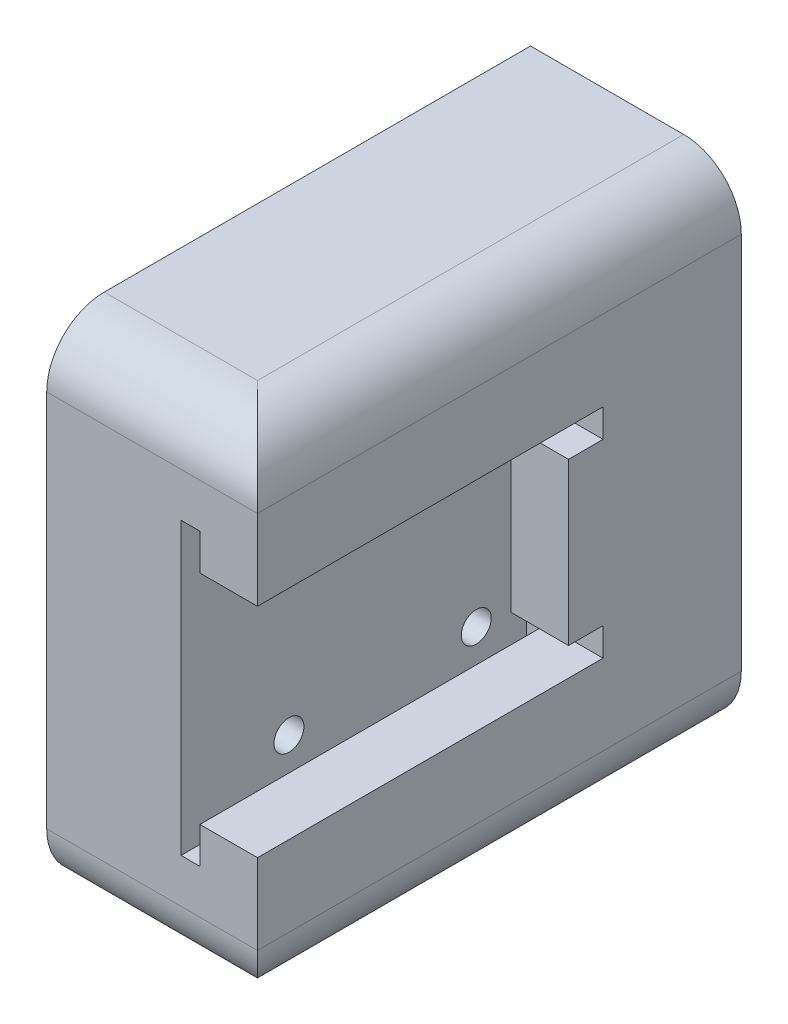
from build123d import *

# Parameters (mm, degrees)
SKETCH_1_W          = 18.3
SKETCH_1_H          = 42.85
SKETCH_1_R          = 1.55
EXTRUDE_1_DEPTH     = 7
SKETCH_2_W          = 5
SKETCH_2_H          = 14
EXTRUDE_4_DEPTH     = 8
SKETCH_5_W          = 5
SKETCH_5_H          = 3.15
EXTRUDE_5_DEPTH     = 35
EXTRUDE_7_DEPTH     = 35
EXTRUDE_8_DEPTH     = 5
CUT_EXTRUDE_1_REACH = 63.123
SKETCH_9_R          = 1.3
SKETCH_11_R         = 1.55
CUT_EXTRUDE_2_DEPTH = 32
SKETCH_12_W         = 6
SKETCH_12_H         = 6
CUT_EXTRUDE_3_DEPTH = 3.2
FILLET_1_R          = 5


with BuildPart() as part:
    # 草图1 → 凸台-拉伸1 (new body)
    with BuildSketch(Plane.XY):
        with Locations((9.15, -21.425)):
            Rectangle(SKETCH_1_W, SKETCH_1_H)
        with Locations((5.15, -5)):
            Circle(SKETCH_1_R, mode=Mode.SUBTRACT)
        with Locations((5.15, -37.96)):
            Circle(SKETCH_1_R, mode=Mode.SUBTRACT)
        with Locations(Location((13.15, -37.96, 0), (0, 0, 180))):
            Circle(SKETCH_1_R, mode=Mode.SUBTRACT)
        with Locations(Location((13.15, -5, 0), (0, 0, 180))):
            Circle(SKETCH_1_R, mode=Mode.SUBTRACT)
    extrude(amount=EXTRUDE_1_DEPTH)

    # 草图2 → 凸台-拉伸4 (add)
    with BuildSketch(Plane.XY.offset(7)):
        with Locations((15.8, -21.425)):
            Rectangle(SKETCH_2_W, SKETCH_2_H)
    extrude(amount=EXTRUDE_4_DEPTH)

    # 草图5 → 凸台-拉伸5 (add)
    with BuildSketch(Plane.XY.offset(7)):
        with Locations((15.8, -32.45)):
            Rectangle(SKETCH_5_W, SKETCH_5_H)
        with Locations((15.8, -10.4)):
            Rectangle(SKETCH_5_W, SKETCH_5_H)
    extrude(amount=EXTRUDE_5_DEPTH)

    # 草图7 → 凸台-拉伸7 (add)
    with BuildSketch(Plane.XY.offset(7)):
        Polygon((0, 0), (12.7, 0), (18.3, 0), (18.3, -8.825), (11.66, -8.825), (11.66, -34.025), (18.3, -34.025), (18.3, -42.85), (12.7, -42.85), (0, -42.85), align=None)
    extrude(amount=EXTRUDE_7_DEPTH)

    # 草图8 → 凸台-拉伸8 (add)
    with BuildSketch(Plane.XY.offset(7)):
        Polygon((13.3, -30.875), (13.3, -34.025), (11.66, -34.025), (11.66, -8.825), (13.3, -8.825), (13.3, -11.975), (18.3, -11.975), (18.3, -14.425), (13.3, -14.425), (13.3, -28.425), (18.3, -28.425), (18.3, -30.875), align=None)
    extrude(amount=EXTRUDE_8_DEPTH)

    # 草图9 → 切除-拉伸1 (cut, up to next)
    with BuildSketch(Plane(origin=(11.66, 0, 0), x_dir=(0, 0, -1), z_dir=(1, 0, 0)), mode=Mode.PRIVATE) as cut_extrude_1_sk1:
        with Locations(Location((-16.37, -13.195, 0), (0, 0, 90))):
            Circle(SKETCH_9_R)
    cut_extrude_1_tool1 = extrude(cut_extrude_1_sk1.sketch, amount=-CUT_EXTRUDE_1_REACH, mode=Mode.PRIVATE) & part.part
    # 草图9 → 切除-拉伸1 (cut, up to next)
    with BuildSketch(Plane(origin=(11.66, 0, 0), x_dir=(0, 0, -1), z_dir=(1, 0, 0)), mode=Mode.PRIVATE) as cut_extrude_1_sk2:
        with Locations((-16.37, -29.655)):
            Circle(SKETCH_9_R)
    cut_extrude_1_tool2 = extrude(cut_extrude_1_sk2.sketch, amount=-CUT_EXTRUDE_1_REACH, mode=Mode.PRIVATE) & part.part
    # 草图9 → 切除-拉伸1 (cut, up to next)
    with BuildSketch(Plane(origin=(11.66, 0, 0), x_dir=(0, 0, -1), z_dir=(1, 0, 0)), mode=Mode.PRIVATE) as cut_extrude_1_sk3:
        with Locations(Location((-32.63, -13.195, 0), (0, 0, 90))):
            Circle(SKETCH_9_R)
    cut_extrude_1_tool3 = extrude(cut_extrude_1_sk3.sketch, amount=-CUT_EXTRUDE_1_REACH, mode=Mode.PRIVATE) & part.part
    # 草图9 → 切除-拉伸1 (cut, up to next)
    with BuildSketch(Plane(origin=(11.66, 0, 0), x_dir=(0, 0, -1), z_dir=(1, 0, 0)), mode=Mode.PRIVATE) as cut_extrude_1_sk4:
        with Locations((-32.63, -29.655)):
            Circle(SKETCH_9_R)
    cut_extrude_1_tool4 = extrude(cut_extrude_1_sk4.sketch, amount=-CUT_EXTRUDE_1_REACH, mode=Mode.PRIVATE) & part.part
    add(cut_extrude_1_tool1.solids().sort_by_distance((11.66, -13.195, 16.37))[0], mode=Mode.SUBTRACT)
    add(cut_extrude_1_tool2.solids().sort_by_distance((11.66, -29.655, 16.37))[0], mode=Mode.SUBTRACT)
    add(cut_extrude_1_tool3.solids().sort_by_distance((11.66, -13.195, 32.63))[0], mode=Mode.SUBTRACT)
    add(cut_extrude_1_tool4.solids().sort_by_distance((11.66, -29.655, 32.63))[0], mode=Mode.SUBTRACT)

    # 草图11 → 切除-拉伸2 (cut)
    with BuildSketch(Plane(origin=(0, 0, 0), x_dir=(-1, 0, 0), z_dir=(0, 0, -1))):
        with Locations((-13.15, -5)):
            Circle(SKETCH_11_R)
        with Locations((-5.15, -5)):
            Circle(SKETCH_11_R)
        with Locations((-5.15, -37.96)):
            Circle(SKETCH_11_R)
        with Locations((-13.15, -37.96)):
            Circle(SKETCH_11_R)
    extrude(amount=-CUT_EXTRUDE_2_DEPTH, mode=Mode.SUBTRACT)

    # 草图12 → 切除-拉伸3 (cut)
    with BuildSketch(Plane.XY.offset(25)):
        with Locations((13.15, -5)):
            Rectangle(SKETCH_12_W, SKETCH_12_H)
        with Locations((5.15, -5)):
            Rectangle(SKETCH_12_W, SKETCH_12_H)
        with Locations((13.15, -37.96)):
            Rectangle(SKETCH_12_W, SKETCH_12_H)
        with Locations((5.15, -37.96)):
            Rectangle(SKETCH_12_W, SKETCH_12_H)
    extrude(amount=-CUT_EXTRUDE_3_DEPTH, mode=Mode.SUBTRACT)

    # 圆角1
    fillet_1_edges = [part.edges().sort_by_distance(p)[0] for p in [
        (9.15, -42.85, 42),
        (18.3, 0, 21),
        (18.3, -42.85, 21),
        (9.15, 0, 42),
    ]]
    fillet(fillet_1_edges, radius=FILLET_1_R)


solid = part.part
